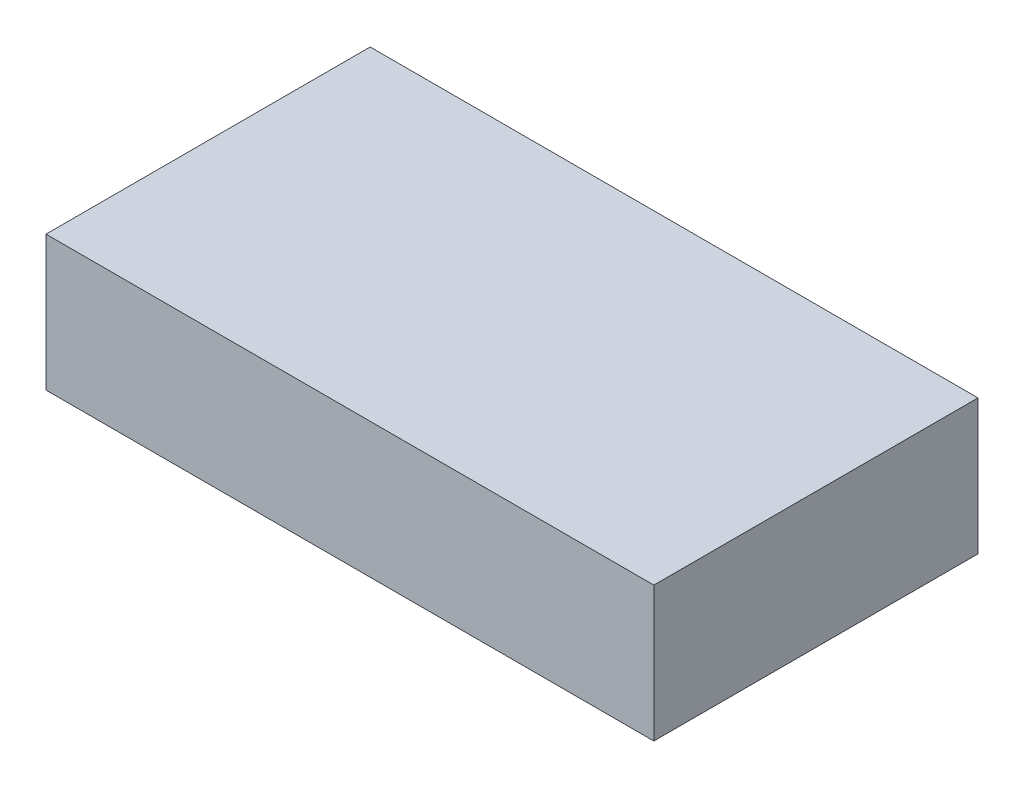
from build123d import *

# Parameters (mm, degrees)
SKETCH1_W                        = 45
SKETCH1_H                        = 24
BATTERY_MODEL_JUST_A_BLOCK_DEPTH = 10


with BuildPart() as part:
    # Sketch1 → battery model, just a block (new body)
    with BuildSketch(Plane(origin=(0, 0, 0), x_dir=(1, 0, 0), z_dir=(0, 1, 0))):
        with Locations((22.5, 12)):
            Rectangle(SKETCH1_W, SKETCH1_H)
    extrude(amount=BATTERY_MODEL_JUST_A_BLOCK_DEPTH)


solid = part.part
